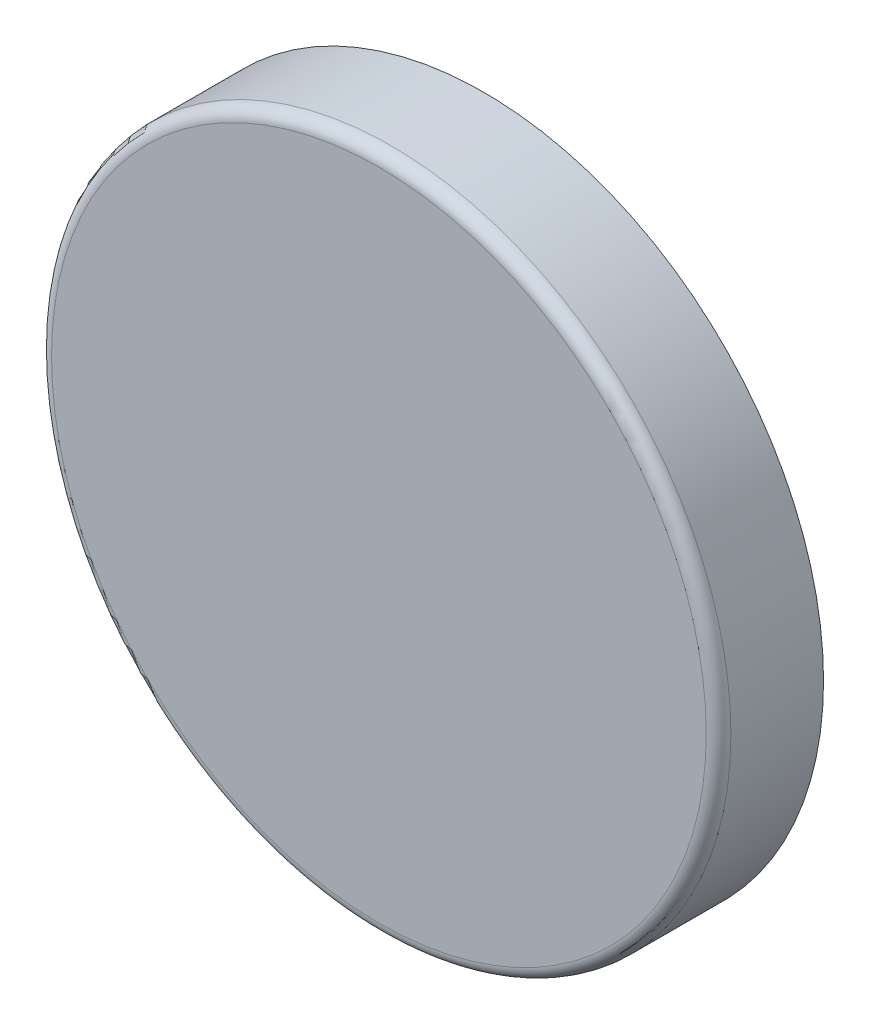
from build123d import *

# Parameters (mm, degrees)
SKETCH1_R           = 55
BOSS_EXTRUDE1_DEPTH = 17
FILLET1_R           = 2


with BuildPart() as part:
    # Sketch1 → Boss-Extrude1 (new body)
    with BuildSketch(Plane.XY.offset(1312.016538235)):
        with Locations((907.54900926, 1390.826569381)):
            Circle(SKETCH1_R)
    extrude(amount=BOSS_EXTRUDE1_DEPTH)

    # Fillet1
    fillet1_edges = [part.edges().sort_by_distance(p)[0] for p in [
        (852.54900926, 1390.826569381, 1329.016538235),
    ]]
    fillet(fillet1_edges, radius=FILLET1_R)


solid = part.part
